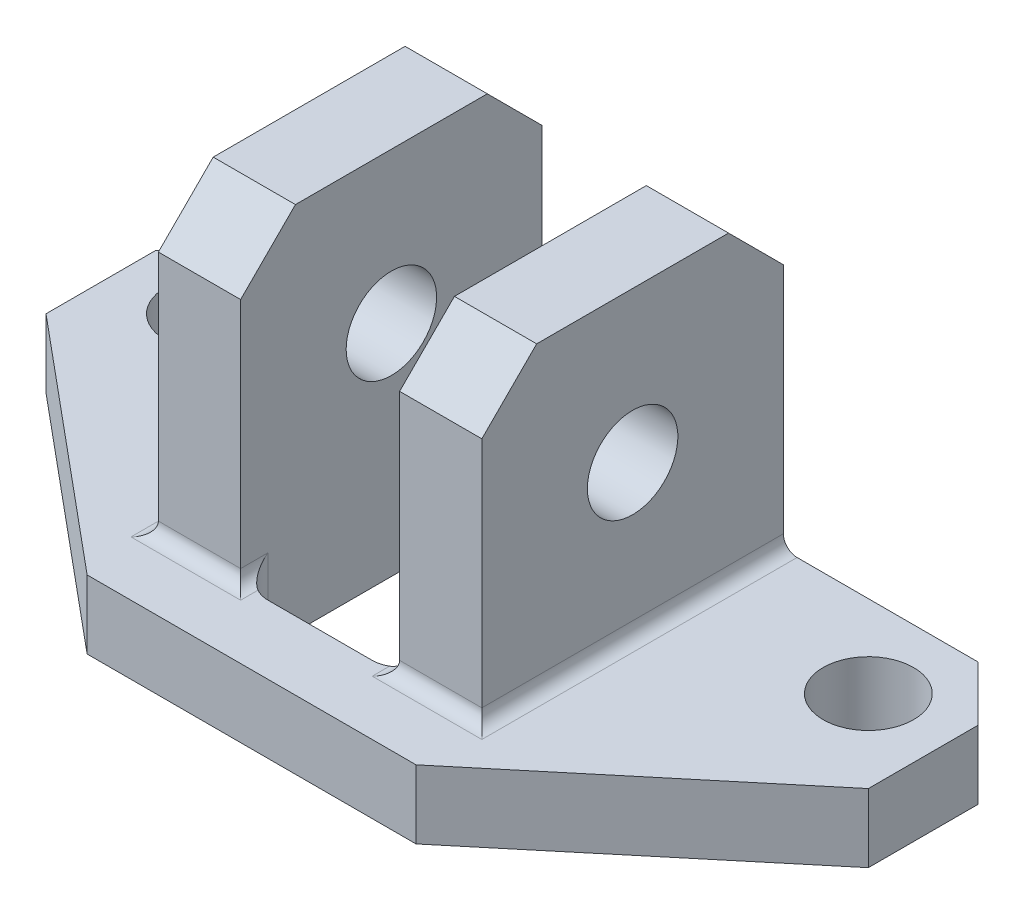
from build123d import *

# Parameters (mm, degrees)
SKETCH_1_W          = 30
SKETCH_1_H          = 16
EXTRUDE_1_DEPTH     = 2.5
SKETCH_3_R          = 1.65
CUT_EXTRUDE_1_DEPTH = 2.5
SKETCH_4_W          = 5.8
SKETCH_4_H          = 11
CUT_EXTRUDE_2_DEPTH = 2.5
SKETCH_5_W          = 3
SKETCH_5_H          = 11
EXTRUDE_2_DEPTH     = 11
SKETCH_6_R          = 1.65
CUT_EXTRUDE_3_DEPTH = 27.135416584
CUT_EXTRUDE_4_DEPTH = 21.248456731
CHAMFER_1_SIZE      = 2
FILLET_1_R          = 1
FILLET_2_R          = 0.5
CUT_EXTRUDE_6_DEPTH = 21.248456731


with BuildPart() as part:
    # 草图1 → 凸台-拉伸1 (new body)
    with BuildSketch(Plane(origin=(0, 0, 0), x_dir=(1, 0, 0), z_dir=(0, 1, 0))):
        Rectangle(SKETCH_1_W, SKETCH_1_H)
    extrude(amount=EXTRUDE_1_DEPTH)

    # 草图3 → 切除-拉伸1 (cut)
    with BuildSketch(Plane(origin=(0, 2.5, 0), x_dir=(1, 0, 0), z_dir=(0, 1, 0))):
        with Locations(Location((-12, 5, 0), (0, 0, 270))):
            Circle(SKETCH_3_R)
        with Locations(Location((12, 5, 0), (0, 0, 90))):
            Circle(SKETCH_3_R)
        with Locations(Location((12, -5, 0), (0, 0, 270))):
            Circle(SKETCH_3_R)
        with Locations(Location((-12, -5, 0), (0, 0, 90))):
            Circle(SKETCH_3_R)
        with Locations(Location((0, 5, 0), (0, 0, 270))):
            Circle(SKETCH_3_R)
    extrude(amount=-CUT_EXTRUDE_1_DEPTH, mode=Mode.SUBTRACT)

    # 草图4 → 切除-拉伸2 (cut)
    with BuildSketch(Plane(origin=(0, 2.5, 0), x_dir=(1, 0, 0), z_dir=(0, 1, 0))):
        with Locations((0, 2.5)):
            Rectangle(SKETCH_4_W, SKETCH_4_H)
    extrude(amount=-CUT_EXTRUDE_2_DEPTH, mode=Mode.SUBTRACT)

    # 草图5 → 凸台-拉伸2 (add)
    with BuildSketch(Plane(origin=(0, 2.5, 0), x_dir=(1, 0, 0), z_dir=(0, 1, 0))):
        with Locations((-4.4, 2.5)):
            Rectangle(SKETCH_5_W, SKETCH_5_H)
        with Locations((4.4, 2.5)):
            Rectangle(SKETCH_5_W, SKETCH_5_H)
    extrude(amount=EXTRUDE_2_DEPTH)

    # 草图6 → 切除-拉伸3 (cut, through all)
    with BuildSketch(Plane.ZY.offset(5.9)):
        with Locations((-2.5, 8)):
            Circle(SKETCH_6_R)
    extrude(amount=-CUT_EXTRUDE_3_DEPTH, mode=Mode.SUBTRACT)

    # 草图7 → 切除-拉伸4 (cut, through all)
    with BuildSketch(Plane(origin=(0, 2.5, 0), x_dir=(1, 0, 0), z_dir=(0, 1, 0))):
        Polygon((-15, 2), (-3, -8), (-15, -8), align=None)
        Polygon((3, -8), (15, -8), (15, 2), align=None)
    extrude(amount=-CUT_EXTRUDE_4_DEPTH, mode=Mode.SUBTRACT)

    # 倒角1
    chamfer_1_edges = [part.edges().sort_by_distance(p)[0] for p in [
        (-4.4, 13.5, -8),
        (-4.4, 13.5, 3),
        (4.4, 13.5, 3),
        (4.4, 13.5, -8),
        (-15, 1.25, -8),
        (15, 1.25, -8),
    ]]
    chamfer(chamfer_1_edges, length=CHAMFER_1_SIZE)

    # 圆角1
    fillet_1_edges = [part.edges().sort_by_distance(p)[0] for p in [
        (-2.9, 1.25, 3),
        (2.9, 1.25, 3),
    ]]
    fillet(fillet_1_edges, radius=FILLET_1_R)

    # 圆角2
    fillet_2_edges = [part.edges().sort_by_distance(p)[0] for p in [
        (-2.9, 2.5, 2.5),
        (2.9, 2.5, 2.5),
        (-5.9, 2.5, -2.5),
        (-4.4, 2.5, 3),
        (4.4, 2.5, 3),
        (5.9, 2.5, -2.5),
    ]]
    fillet(fillet_2_edges, radius=FILLET_2_R)

    # 草图8 → 切除-拉伸6 (cut, through all)
    with BuildSketch(Plane(origin=(0, 2.5, 0), x_dir=(1, 0, 0), z_dir=(0, 1, 0))):
        Polygon((-6, -5.5), (6, -5.5), (3, -8), (-3, -8), align=None)
    extrude(amount=-CUT_EXTRUDE_6_DEPTH, mode=Mode.SUBTRACT)


solid = part.part
